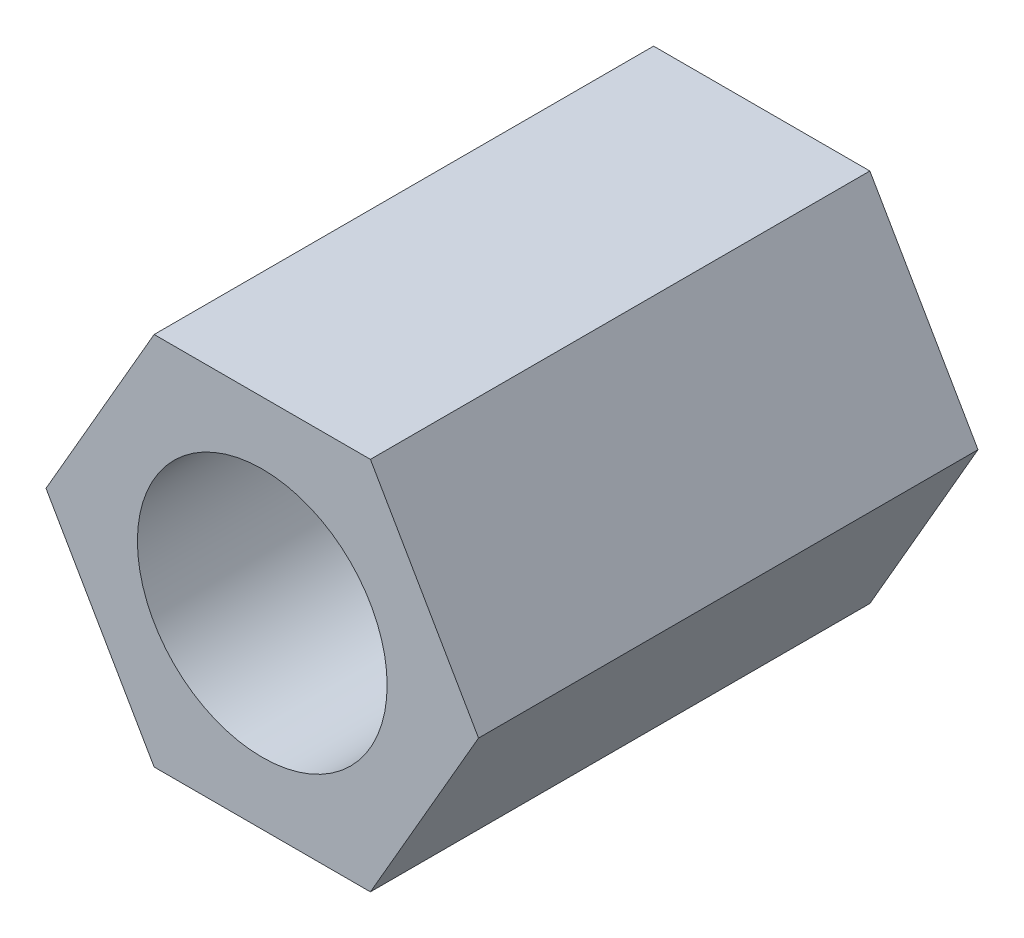
from build123d import *

# Parameters (mm, degrees)
SKETCH_1_R      = 2
EXTRUDE_1_DEPTH = 8


with BuildPart() as part:
    # 草图1 → 凸台-拉伸1 (new body)
    with BuildSketch(Plane.XY):
        Polygon((3.464101615, 0), (1.732050808, 3), (-1.732050808, 3), (-3.464101615, 0), (-1.732050808, -3), (1.732050808, -3), align=None)
        Circle(SKETCH_1_R, mode=Mode.SUBTRACT)
    extrude(amount=EXTRUDE_1_DEPTH)


solid = part.part
